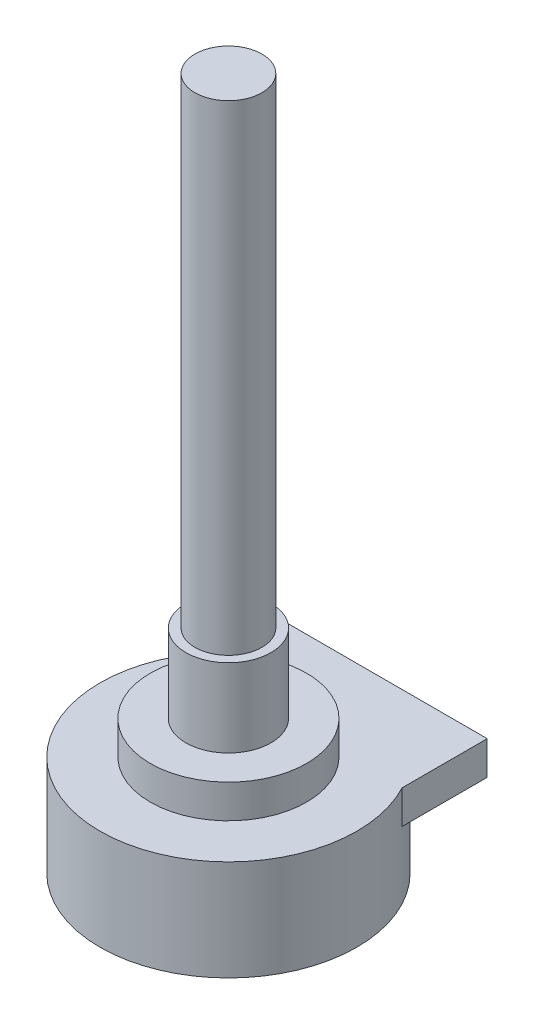
from build123d import *

# Parameters (mm, degrees)
SKETCH1_R           = 7
BOSS_EXTRUDE1_DEPTH = 9
SKETCH1_3_R         = 7
SKETCH1_3_R_2       = 3.81
BOSS_EXTRUDE2_DEPTH = 12
SKETCH1_4_R         = 3.81
SKETCH1_4_R_2       = 3
BOSS_EXTRUDE3_DEPTH = 19
SKETCH1_5_R         = 3
BOSS_EXTRUDE4_DEPTH = 62
CUT_EXTRUDE1_DEPTH  = 6


with BuildPart() as part:
    # Sketch1 → Boss-Extrude1 (new body)
    with BuildSketch(Plane(origin=(0, 0, 0), x_dir=(1, 0, 0), z_dir=(0, 1, 0))):
        with BuildLine():
            Line((11.2776, 8.7884), (-9.0424, 8.7884))
            Line((-9.0424, 8.7884), (-9.0424, 1.1684))
            ThreePointArc((-9.0424, 1.1684), (1.1176, -15.719029814), (11.2776, 1.1684))
            Line((11.2776, 1.1684), (11.2776, 8.7884))
        make_face()
        with Locations((1.1176, -4.219029814)):
            Circle(SKETCH1_R, mode=Mode.SUBTRACT)
    extrude(amount=BOSS_EXTRUDE1_DEPTH)

    # Sketch1<3> → Boss-Extrude2 (add)
    with BuildSketch(Plane(origin=(0, 0, 0), x_dir=(1, 0, 0), z_dir=(0, 1, 0))):
        with Locations((1.1176, -4.219029814)):
            Circle(SKETCH1_3_R)
        with Locations((1.1176, -4.219029814)):
            Circle(SKETCH1_3_R_2, mode=Mode.SUBTRACT)
    extrude(amount=BOSS_EXTRUDE2_DEPTH)

    # Sketch1<4> → Boss-Extrude3 (add)
    with BuildSketch(Plane(origin=(0, 0, 0), x_dir=(1, 0, 0), z_dir=(0, 1, 0))):
        with Locations((1.1176, -4.219029814)):
            Circle(SKETCH1_4_R)
        with Locations((1.1176, -4.219029814)):
            Circle(SKETCH1_4_R_2, mode=Mode.SUBTRACT)
    extrude(amount=BOSS_EXTRUDE3_DEPTH)

    # Sketch1<5> → Boss-Extrude4 (add)
    with BuildSketch(Plane(origin=(0, 0, 0), x_dir=(1, 0, 0), z_dir=(0, 1, 0))):
        with Locations((1.1176, -4.219029814)):
            Circle(SKETCH1_5_R)
    extrude(amount=BOSS_EXTRUDE4_DEPTH)

    # Sketch2 → Cut-Extrude1 (cut)
    with BuildSketch(Plane(origin=(0, 0, 0), x_dir=(-1, 0, 0), z_dir=(0, -1, 0))):
        with BuildLine():
            Line((9.0424, 1.1684), (9.0424, 8.7884))
            Line((9.0424, 8.7884), (-11.2776, 8.7884))
            Line((-11.2776, 8.7884), (-11.2776, 1.1684))
            ThreePointArc((-11.2776, 1.1684), (-1.1176, 7.280970186), (9.0424, 1.1684))
        make_face()
    extrude(amount=-CUT_EXTRUDE1_DEPTH, mode=Mode.SUBTRACT)


solid = part.part
